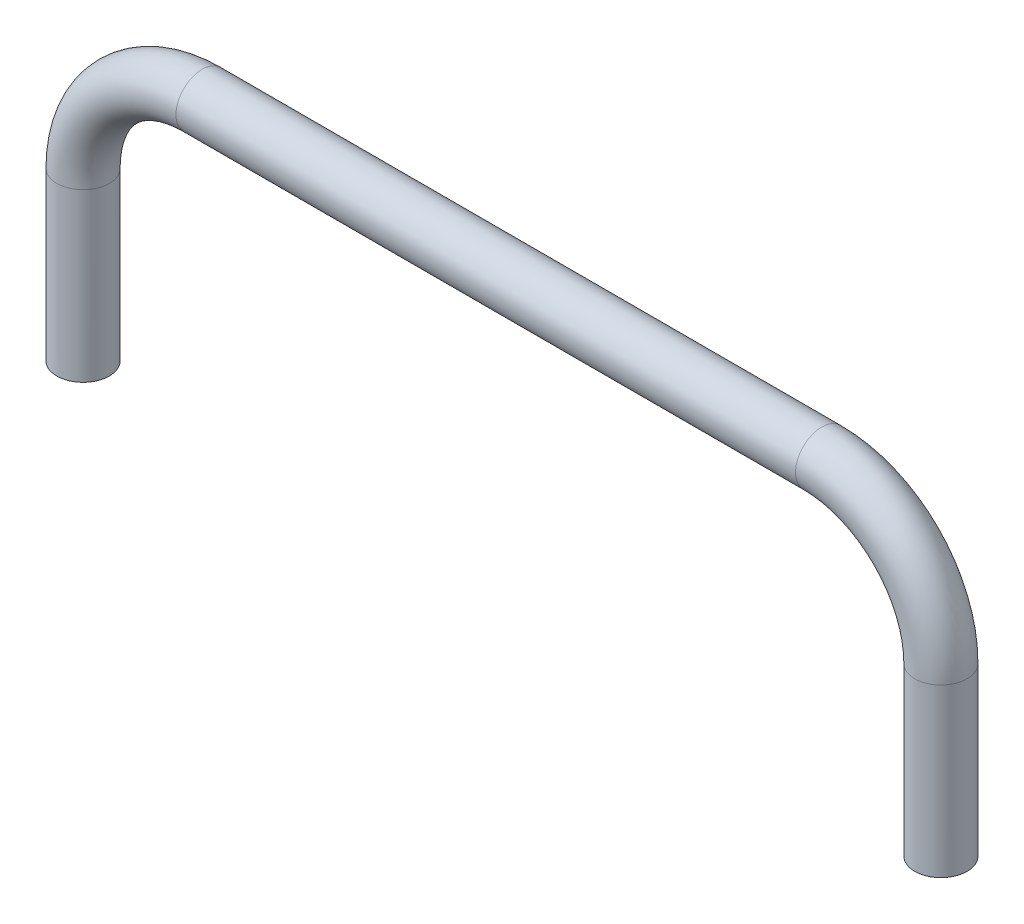
from build123d import *

# Parameters (mm, degrees)
SKETCH_1_R = 11


with BuildPart() as part:
    # 扫描1: sweep along a path in 草图2
    with BuildLine(Plane.XY) as sweep_1_path:
        Line((-180, 0), (-180, 70))
        ThreePointArc((-180, 70), (-165.355339059, 105.355339059), (-130, 120))
        Line((-130, 120), (130, 120))
        ThreePointArc((130, 120), (165.355339059, 105.355339059), (180, 70))
        Line((180, 70), (180, 0))
    # 草图1 → 扫描1 (sweep)
    with BuildSketch(Plane(origin=(0, 0, 0), x_dir=(1, 0, 0), z_dir=(0, 1, 0))):
        with Locations((-180, 0)):
            Circle(SKETCH_1_R)
    sweep(path=sweep_1_path.line)


solid = part.part
